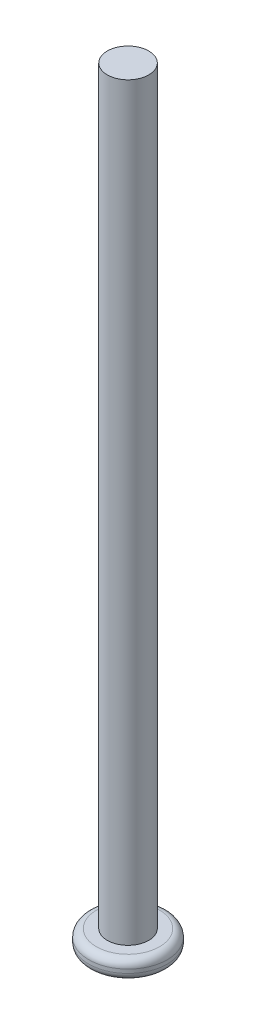
from build123d import *

# Parameters (mm, degrees)
FILLET1_R = 1


with BuildPart() as part:
    # Sketch1 → Revolve1 (revolve)
    with BuildSketch(Plane.XY, mode=Mode.PRIVATE) as revolve1_sk:
        Polygon((-2.75, 102), (-2.75, 2.5), (-5.2, 2.5), (-5.2, 0), (0, 0), (0, 102), align=None)
    revolve(revolve1_sk.sketch.rotate(Axis((0, 0, 0), (0, 1, 0)), 180), axis=Axis((0, 0, 0), (0, 1, 0)))

    # Fillet1
    fillet1_edges = [part.edges().sort_by_distance(p)[0] for p in [
        (-5.2, 0, 0),
        (-5.2, 2.5, 0),
    ]]
    fillet(fillet1_edges, radius=FILLET1_R)


solid = part.part
